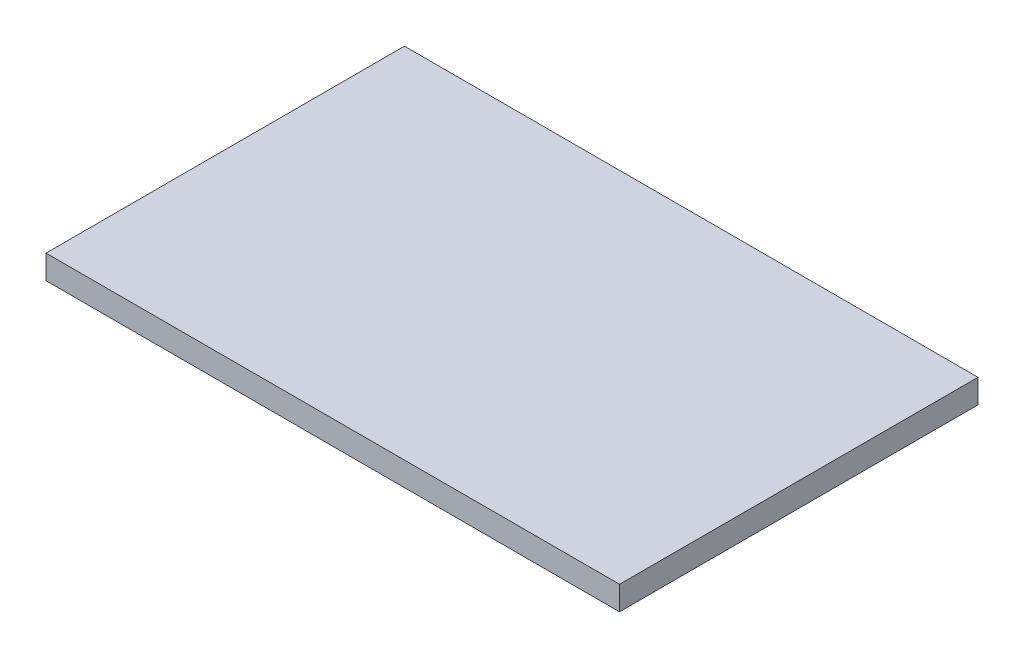
from build123d import *

# Parameters (mm, degrees)
SKIZZE1_W                       = 120
SKIZZE1_H                       = 75
AUFSATZ_LINEAR_AUSTRAGEN1_DEPTH = 5


with BuildPart() as part:
    # Skizze1 → Aufsatz-Linear austragen1 (new body)
    with BuildSketch(Plane(origin=(0, 0, 0), x_dir=(1, 0, 0), z_dir=(0, 1, 0))):
        with Locations((60, 37.5)):
            Rectangle(SKIZZE1_W, SKIZZE1_H)
    extrude(amount=AUFSATZ_LINEAR_AUSTRAGEN1_DEPTH)


solid = part.part
